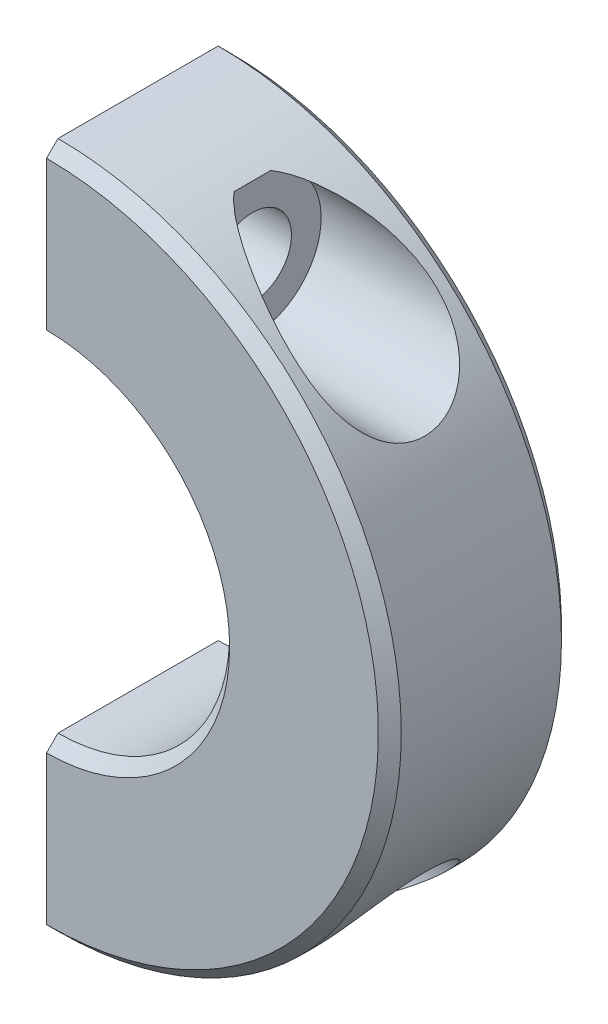
from build123d import *

# Parameters (mm, degrees)
EXTRUDE_1_DEPTH     = 8
CUT_EXTRUDE_START   = -5
SKETCH_2_R          = 3
CUT_EXTRUDE_1_DEPTH = 10
SKETCH_2_3_R        = 1.7
CUT_EXTRUDE_2_DEPTH = 5
SKETCH_3_R          = 1.7
CUT_EXTRUDE_4_DEPTH = 5
SKETCH_3_3_R        = 3
CUT_EXTRUDE_3_DEPTH = 10
CHAMFER_1_SIZE      = 0.5


with BuildPart() as part:
    # 草图1 → 凸台-拉伸1 (new body)
    with BuildSketch(Plane.XY):
        with BuildLine():
            Line((-7.824326088, 23.005235362), (-7.824326088, 15.505235362))
            ThreePointArc((-7.824326088, 15.505235362), (-0.324326088, 8.005235362), (-7.824326088, 0.505235362))
            Line((-7.824326088, 0.505235362), (-7.824326088, -6.994764638))
            ThreePointArc((-7.824326088, -6.994764638), (7.175673912, 8.005235362), (-7.824326088, 23.005235362))
        make_face()
    extrude(amount=EXTRUDE_1_DEPTH)

    # 草图2 → 切除-拉伸1 (cut)
    with BuildSketch(Plane.ZY.offset(7.824326088).offset(CUT_EXTRUDE_START)):
        with Locations((4, 19.255235362)):
            Circle(SKETCH_2_R)
    extrude(amount=-CUT_EXTRUDE_1_DEPTH, mode=Mode.SUBTRACT)

    # 草图2<3> → 切除-拉伸2 (cut)
    with BuildSketch(Plane.ZY.offset(7.824326088)):
        with Locations((4, 19.255235362)):
            Circle(SKETCH_2_3_R)
    extrude(amount=-CUT_EXTRUDE_2_DEPTH, mode=Mode.SUBTRACT)

    # 草图3 → 切除-拉伸4 (cut)
    with BuildSketch(Plane.ZY.offset(7.824326088)):
        with Locations((4, -3.244764638)):
            Circle(SKETCH_3_R)
    extrude(amount=-CUT_EXTRUDE_4_DEPTH, mode=Mode.SUBTRACT)

    # 草图3<3> → 切除-拉伸3 (cut)
    with BuildSketch(Plane.ZY.offset(7.824326088).offset(CUT_EXTRUDE_START)):
        with Locations((4, -3.244764638)):
            Circle(SKETCH_3_3_R)
    extrude(amount=-CUT_EXTRUDE_3_DEPTH, mode=Mode.SUBTRACT)

    # 倒角1
    chamfer_1_edges = [part.edges().sort_by_distance(p)[0] for p in [
        (7.175673912, 8.005235362, 0),
        (7.175673912, 8.005235362, 8),
        (-0.324326088, 8.005235362, 0),
        (-0.324326088, 8.005235362, 8),
    ]]
    chamfer(chamfer_1_edges, length=CHAMFER_1_SIZE)


solid = part.part
